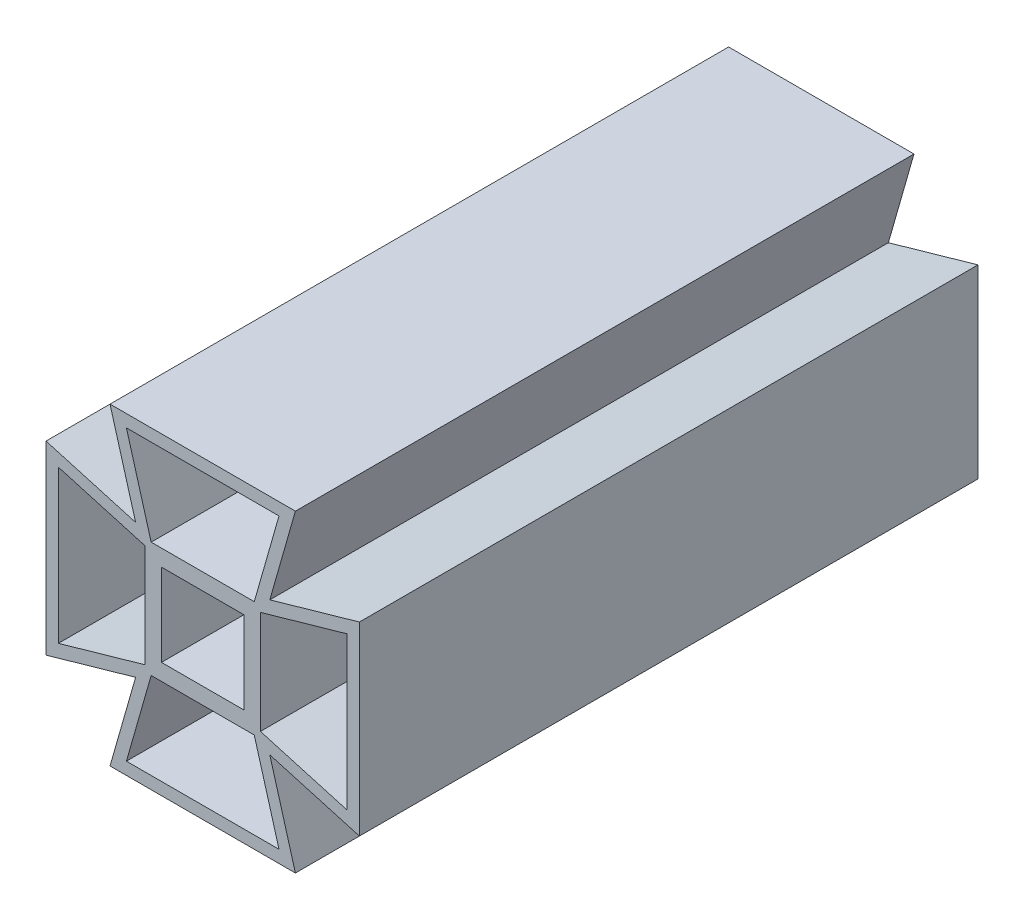
from build123d import *

# Parameters (mm, degrees)
SKETCH1_W           = 20
SKETCH1_H           = 20
BOSS_EXTRUDE1_DEPTH = 150
SKETCH2_W           = 7
SKETCH2_H           = 21
SKETCH2_W_2         = 21
SKETCH2_H_2         = 7
BOSS_EXTRUDE2_DEPTH = 2


with BuildPart() as part:
    # Sketch1 → Boss-Extrude1 (new body)
    with BuildSketch(Plane.XY):
        Polygon((22.477189953, 38), (-22.477189953, 38), (-16.268065934, 16.268065934), (-38, 22.477189953), (-38, -22.477189953), (-16.268065934, -16.268065934), (-22.477189953, -38), (22.477189953, -38), (16.268065934, -16.268065934), (38, -22.477189953), (38, 22.477189953), (16.268065934, 16.268065934), align=None)
        Polygon((12.5, 14), (-12.5, 14), (-18.5, 35), (18.5, 35), align=None, mode=Mode.SUBTRACT)
        Rectangle(SKETCH1_W, SKETCH1_H, mode=Mode.SUBTRACT)
        Polygon((14, -12.5), (14, 12.5), (35, 18.5), (35, -18.5), align=None, mode=Mode.SUBTRACT)
        Polygon((-12.5, -14), (12.5, -14), (18.5, -35), (-18.5, -35), align=None, mode=Mode.SUBTRACT)
        Polygon((-14, 12.5), (-14, -12.5), (-35, -18.5), (-35, 18.5), align=None, mode=Mode.SUBTRACT)
    extrude(amount=BOSS_EXTRUDE1_DEPTH)

    # Sketch2 → Boss-Extrude2 (add)
    with BuildSketch(Plane.XY):
        with Locations((0, 24.5)):
            Rectangle(SKETCH2_W, SKETCH2_H)
        with Locations((24.5, 0)):
            Rectangle(SKETCH2_W_2, SKETCH2_H_2)
        with Locations((0, -24.5)):
            Rectangle(SKETCH2_W, SKETCH2_H)
        with Locations((-24.5, 0)):
            Rectangle(SKETCH2_W_2, SKETCH2_H_2)
    extrude(amount=BOSS_EXTRUDE2_DEPTH)


solid = part.part
